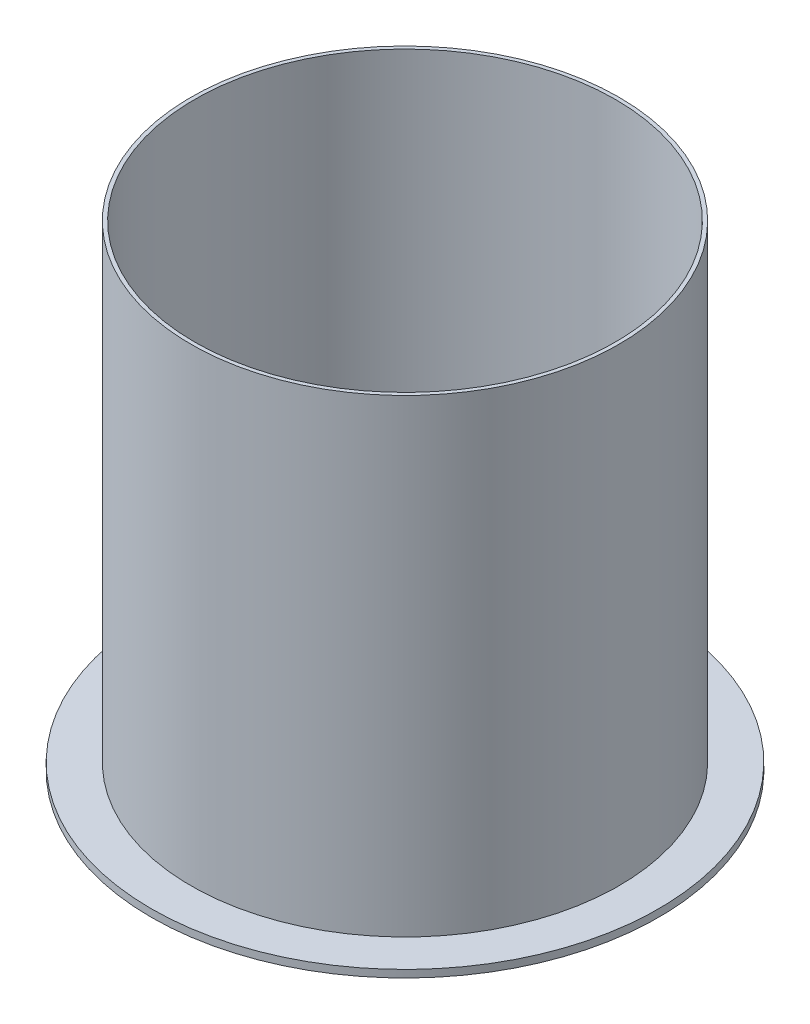
from build123d import *

# Parameters (mm, degrees)
SKETCH1_R           = 1095.375
SKETCH1_R_2         = 1076.325
BOSS_EXTRUDE1_DEPTH = 2438.4
SKETCH2_R           = 1298.575
SKETCH2_R_2         = 1076.325
BOSS_EXTRUDE2_DEPTH = 38.1


with BuildPart() as part:
    # Sketch1 → Boss-Extrude1 (new body)
    with BuildSketch(Plane(origin=(0, 0, 0), x_dir=(1, 0, 0), z_dir=(0, 1, 0))):
        with Locations(Location((0, 0, 0), (0, 0, 90))):
            Circle(SKETCH1_R)
        with Locations(Location((0, 0, 0), (0, 0, 90))):
            Circle(SKETCH1_R_2, mode=Mode.SUBTRACT)
    extrude(amount=BOSS_EXTRUDE1_DEPTH)

    # Sketch2 → Boss-Extrude2 (add)
    with BuildSketch(Plane(origin=(0, 0, 0), x_dir=(1, 0, 0), z_dir=(0, 1, 0))):
        with Locations(Location((0, 0, 0), (0, 0, 90))):
            Circle(SKETCH2_R)
        with Locations(Location((0, 0, 0), (0, 0, 90))):
            Circle(SKETCH2_R_2, mode=Mode.SUBTRACT)
    extrude(amount=BOSS_EXTRUDE2_DEPTH)


solid = part.part
